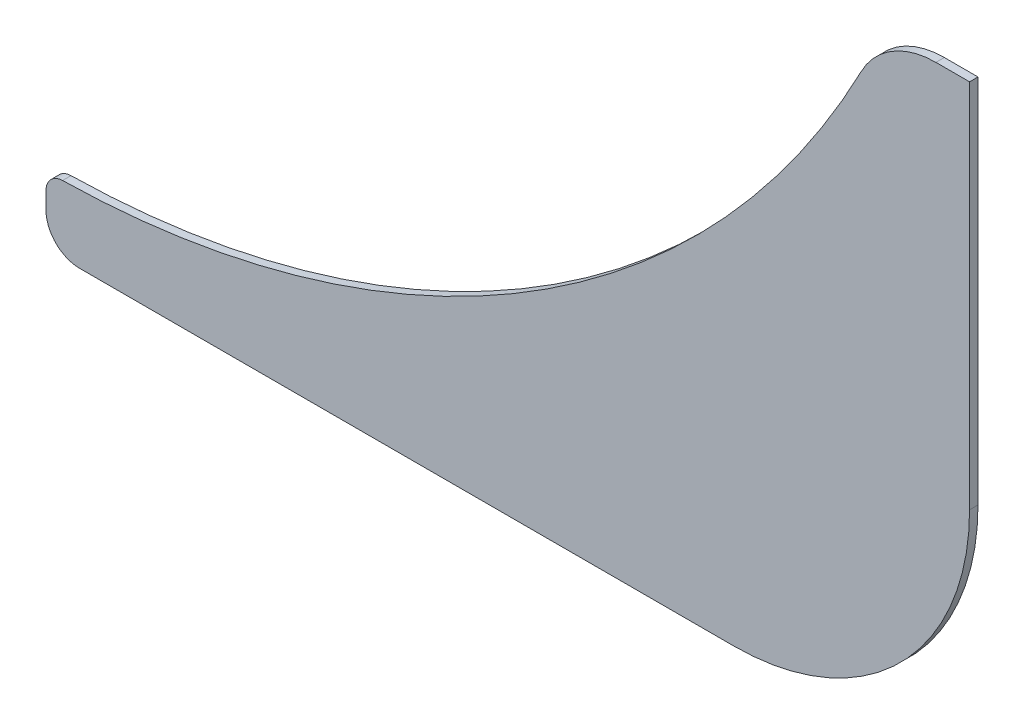
from build123d import *

# Parameters (mm, degrees)
BOSS_EXTRUDE1_DEPTH = 6.35
FILLET1_R           = 12.7


with BuildPart() as part:
    # Sketch1 → Boss-Extrude1 (new body)
    with BuildSketch(Plane.XY):
        with BuildLine():
            Line((-107.95, -236.22), (-107.95, -261.62))
            ThreePointArc((-107.95, -261.62), (-100.510512242, -279.580512242), (-82.55, -287.02))
            Line((-82.55, -287.02), (410.448811446, -287.02))
            ThreePointArc((410.448811446, -287.02), (536.172397141, -234.943585695), (588.248811446, -109.22))
            Line((588.248811446, -109.22), (588.248811446, 170.18))
            Line((588.248811446, 170.18), (562.848811446, 170.18))
            ThreePointArc((562.848811446, 170.18), (529.945223143, 160.990255724), (506.565274596, 136.080909505))
            ThreePointArc((506.565274596, 136.080909505), (251.298169769, -135.884474844), (-107.95, -236.22))
        make_face()
    extrude(amount=BOSS_EXTRUDE1_DEPTH)

    # Fillet1
    fillet1_edges = [part.edges().sort_by_distance(p)[0] for p in [
        (-107.95, -236.22, 3.175),
    ]]
    fillet(fillet1_edges, radius=FILLET1_R)


solid = part.part
